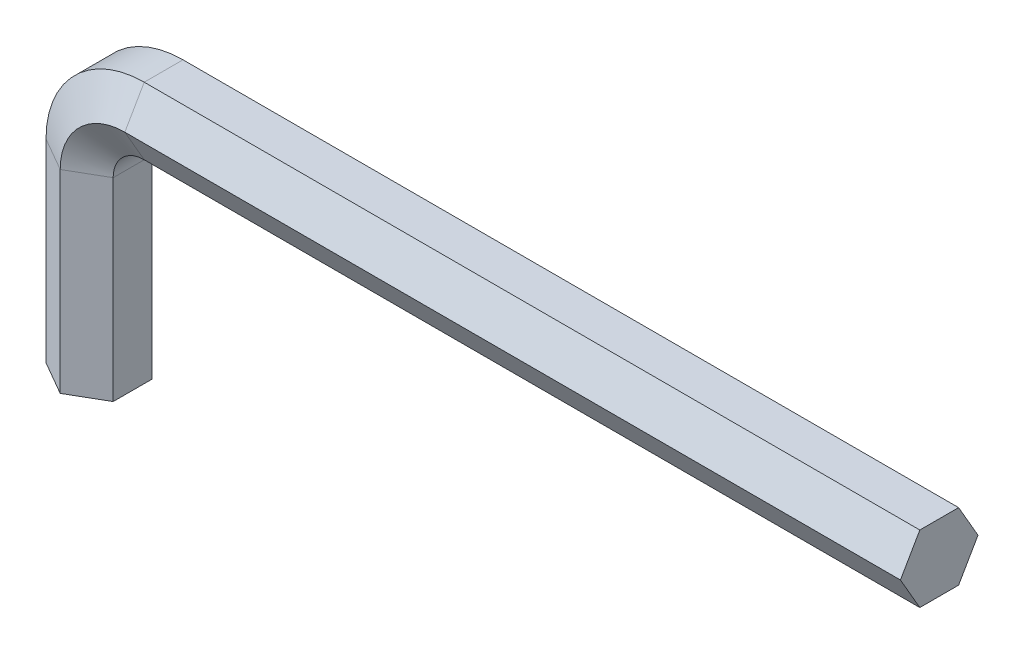
from build123d import *


with BuildPart() as part:
    # Sweep1: sweep along a path in Sketch1
    with BuildLine(Plane.XY) as sweep1_path:
        Line((62.371594817, 20.29786498), (-537.628405183, 20.29786498))
        ThreePointArc((-537.628405183, 20.29786498), (-572.983744242, 5.653204039), (-587.628405183, -29.70213502))
        Line((-587.628405183, -29.70213502), (-587.628405183, -179.70213502))
    # Sketch2 → Sweep1 (sweep)
    with BuildSketch(Plane(origin=(62.371594817, 20.29786498, 0), x_dir=(0, 0, 1), z_dir=(-1, 0, 0))):
        Polygon((30, 0), (15, 25.980762114), (-15, 25.980762114), (-30, 0), (-15, -25.980762114), (15, -25.980762114), align=None)
    sweep(path=sweep1_path.line)


solid = part.part
